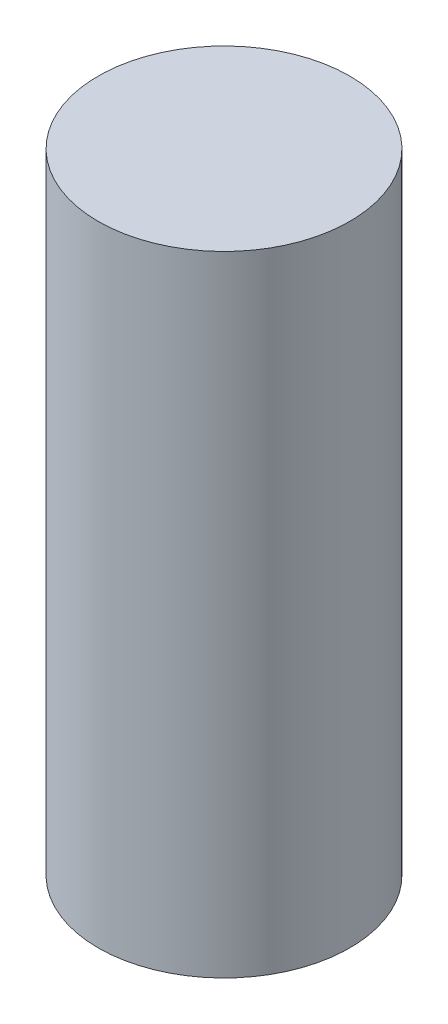
from build123d import *

# Parameters (mm, degrees)
SKETCH1_R           = 8
BOSS_EXTRUDE1_DEPTH = 40


with BuildPart() as part:
    # Sketch1 → Boss-Extrude1 (new body)
    with BuildSketch(Plane(origin=(0, 0, 0), x_dir=(1, 0, 0), z_dir=(0, 1, 0))):
        with Locations(Location((0, 0, 0), (0, 0, 270))):
            Circle(SKETCH1_R)
    extrude(amount=BOSS_EXTRUDE1_DEPTH)


solid = part.part
